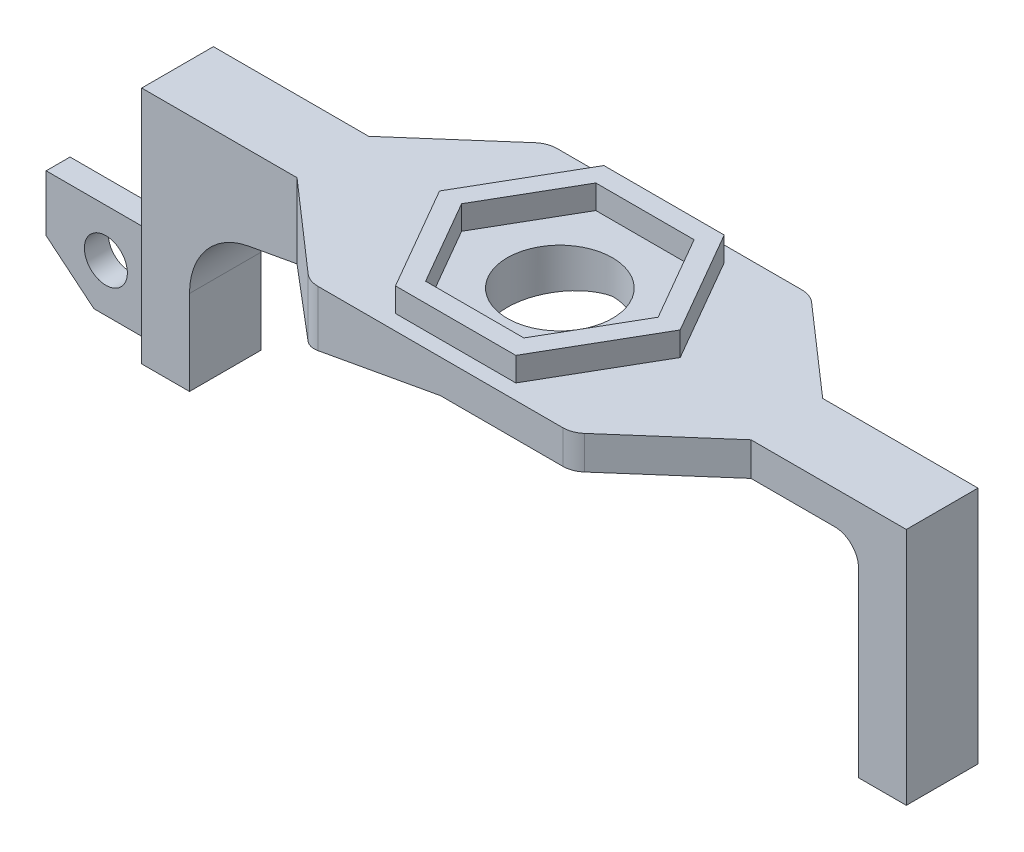
from build123d import *

# Parameters (mm, degrees)
BOSS_EXTRUDE1_DEPTH      = 100
FILLET1_R                = 30
FILLET2_R                = 10
CUT_EXTRUDE1_DEPTH       = 100
CUT_EXTRUDE2_DEPTH       = 100
CUT_EXTRUDE3_DEPTH       = 100
CUT_EXTRUDE4_DEPTH       = 100
FILLET3_R                = 10
SKETCH9_R                = 22
CUT_EXTRUDE5_DEPTH       = 100
BOSS_EXTRUDE2_DEPTH      = 10
SKETCH11_R               = 22
CUT_EXTRUDE6_DEPTH       = 10
CUT_EXTRUDE7_DEPTH       = 10
BOSS_EXTRUDE3_DEPTH      = 5
BOSS_EXTRUDE3_DEPTH_BACK = 5
CUT_EXTRUDE10_DEPTH      = 240.057846604
CUT_EXTRUDE10_DEPTH_BACK = 240.057846604
SKETCH15_R               = 9


with BuildPart() as part:
    # Sketch2 → Boss-Extrude1 (new body)
    with BuildSketch(Plane.XY):
        Polygon((160, 0), (-160, 0), (-160, -100), (-140, -100), (-140, -39.427371229), (0, -14), (140, -14), (140, -100), (160, -100), align=None)
    extrude(amount=BOSS_EXTRUDE1_DEPTH)

    # Fillet1
    fillet1_edges = [part.edges().sort_by_distance(p)[0] for p in [
        (-140, -39.427371229, 50),
    ]]
    fillet(fillet1_edges, radius=FILLET1_R)

    # Fillet2
    fillet2_edges = [part.edges().sort_by_distance(p)[0] for p in [
        (140, -14, 50),
    ]]
    fillet(fillet2_edges, radius=FILLET2_R)

    # Sketch5 → Cut-Extrude1 (cut)
    with BuildSketch(Plane(origin=(0, 0, 0), x_dir=(1, 0, 0), z_dir=(0, 1, 0))):
        Polygon((-160, 0), (-160, -35), (-95, -35), (-55, 0), align=None)
    extrude(amount=-CUT_EXTRUDE1_DEPTH, mode=Mode.SUBTRACT)

    # Sketch6 → Cut-Extrude2 (cut)
    with BuildSketch(Plane(origin=(0, 0, 0), x_dir=(1, 0, 0), z_dir=(0, 1, 0))):
        Polygon((-160, -100), (-160, -65), (-95, -65), (-55, -100), align=None)
    extrude(amount=-CUT_EXTRUDE2_DEPTH, mode=Mode.SUBTRACT)

    # Sketch7 → Cut-Extrude3 (cut)
    with BuildSketch(Plane(origin=(0, 0, 0), x_dir=(1, 0, 0), z_dir=(0, 1, 0))):
        Polygon((160, 0), (160, -34.999520122), (95, -34.999520122), (55, 0), align=None)
    extrude(amount=-CUT_EXTRUDE3_DEPTH, mode=Mode.SUBTRACT)

    # Sketch8 → Cut-Extrude4 (cut)
    with BuildSketch(Plane(origin=(0, 0, 0), x_dir=(1, 0, 0), z_dir=(0, 1, 0))):
        Polygon((160, -100), (160, -65), (95, -65), (55, -100), align=None)
    extrude(amount=-CUT_EXTRUDE4_DEPTH, mode=Mode.SUBTRACT)

    # Fillet3
    fillet3_edges = [part.edges().sort_by_distance(p)[0] for p in [
        (55, -7, 100),
        (-55, -11.994662206, 0),
        (-55, -11.994662206, 100),
        (55, -7, 0),
    ]]
    fillet(fillet3_edges, radius=FILLET3_R)

    # Sketch9 → Cut-Extrude5 (cut)
    with BuildSketch(Plane(origin=(0, 0, 0), x_dir=(1, 0, 0), z_dir=(0, 1, 0))):
        with Locations(Location((0, -50, 0), (0, 0, 180))):
            Circle(SKETCH9_R)
    extrude(amount=-CUT_EXTRUDE5_DEPTH, mode=Mode.SUBTRACT)

    # Sketch10 → Boss-Extrude2 (add)
    with BuildSketch(Plane(origin=(0, 0, 0), x_dir=(1, 0, 0), z_dir=(0, 1, 0))):
        Polygon((-25.182222271, -6.383111579), (-50.364444542, -50), (-25.182222271, -93.616888421), (25.182222271, -93.616888421), (50.364444542, -50), (25.182222271, -6.383111579), align=None)
    extrude(amount=BOSS_EXTRUDE2_DEPTH)

    # Sketch11 → Cut-Extrude6 (cut)
    with BuildSketch(Plane(origin=(0, 10, 0), x_dir=(1, 0, 0), z_dir=(0, 1, 0))):
        with Locations(Location((0, -50, 0), (0, 0, 180))):
            Circle(SKETCH11_R)
    extrude(amount=-CUT_EXTRUDE6_DEPTH, mode=Mode.SUBTRACT)

    # Sketch12 → Cut-Extrude7 (cut)
    with BuildSketch(Plane(origin=(0, 10, 0), x_dir=(1, 0, 0), z_dir=(0, 1, 0))):
        Polygon((41.126840235, -50), (20.563420118, -14.383111579), (-20.563420118, -14.383111579), (-41.126840235, -50), (-20.563420118, -85.616888421), (20.563420118, -85.616888421), align=None)
    extrude(amount=-CUT_EXTRUDE7_DEPTH, mode=Mode.SUBTRACT)

    # Sketch14 → Boss-Extrude3 (add, two sides: drawn at the far end of the back side and taken through both)
    with BuildSketch(Plane.XY.offset(50).offset(-BOSS_EXTRUDE3_DEPTH_BACK)):
        Polygon((-160, -100), (-160, -60), (-210, -60), (-210.056311552, -83.454778124), (-190, -100), align=None)
    extrude(amount=BOSS_EXTRUDE3_DEPTH + BOSS_EXTRUDE3_DEPTH_BACK)

    # Sketch15 → Cut-Extrude10 (cut, two sides: drawn at the far end of the back side and taken through both)
    with BuildSketch(Plane.XY.offset(55).offset(-CUT_EXTRUDE10_DEPTH_BACK)):
        with Locations(Location((-185, -80, 0), (0, 0, 180))):
            Circle(SKETCH15_R)
    extrude(amount=CUT_EXTRUDE10_DEPTH + CUT_EXTRUDE10_DEPTH_BACK, mode=Mode.SUBTRACT)


solid = part.part
